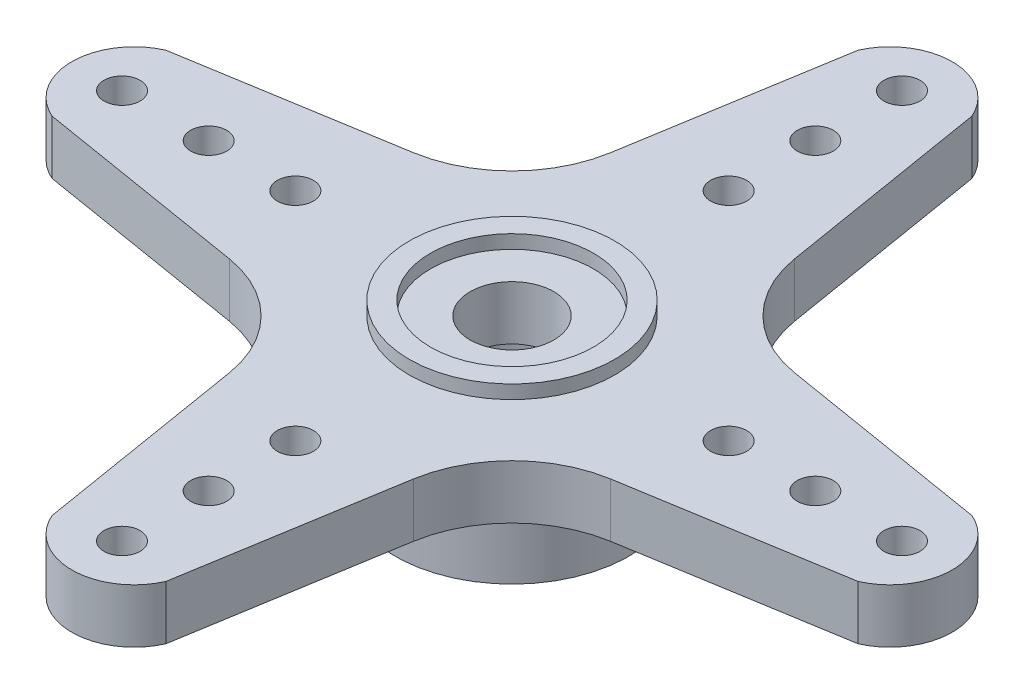
from build123d import *

# Parameters (mm, degrees)
SKETCH1_R           = 4.064
SKETCH1_R_2         = 2.794
BOSS_EXTRUDE1_DEPTH = 3.302
SKETCH2_R           = 0.62500002
SKETCH2_R_2         = 4.064
SKETCH2_R_3         = 2.794
BOSS_EXTRUDE2_DEPTH = 1.87000007
SKETCH6_R           = 1.449999894
CUT_EXTRUDE6_DEPTH  = 23.164493782
SKETCH7_R           = 3.555000002
SKETCH7_R_2         = 2.819999948
BOSS_EXTRUDE3_DEPTH = 0.470000076


with BuildPart() as part:
    # Sketch1 → Boss-Extrude1 (new body)
    with BuildSketch(Plane(origin=(0, 0, 0), x_dir=(1, 0, 0), z_dir=(0, 1, 0))):
        with Locations(Location((0, 0, 0), (0, 0, 90))):
            Circle(SKETCH1_R)
        with Locations(Location((0, 0, 0), (0, 0, 90))):
            Circle(SKETCH1_R_2, mode=Mode.SUBTRACT)
    extrude(amount=BOSS_EXTRUDE1_DEPTH)

    # Sketch2 → Boss-Extrude2 (add)
    # profile 1 of 3: a face of its own
    with BuildSketch(Plane(origin=(0, 3.302, 0), x_dir=(1, 0, 0), z_dir=(0, 1, 0))):
        with BuildLine():
            ThreePointArc((-6.598095019, 3.184398134), (-4.342465091, 4.342465091), (-3.184398134, 6.598095019))
            Line((-3.184398134, 6.598095019), (-1.973411671, 13.950499547))
            ThreePointArc((-1.973411671, 13.950499547), (-1e-09, 15.239999998), (1.973411671, 13.950499548))
            Line((1.973411671, 13.950499548), (3.184398134, 6.598095019))
            ThreePointArc((3.184398134, 6.598095019), (4.342465091, 4.342465091), (6.598095019, 3.184398134))
            Line((6.598095019, 3.184398134), (13.950499547, 1.973411671))
            ThreePointArc((13.950499547, 1.973411671), (15.239999998, 1e-09), (13.950499548, -1.973411671))
            Line((13.950499548, -1.973411671), (6.598095019, -3.184398134))
            ThreePointArc((6.598095019, -3.184398134), (4.342465091, -4.342465091), (3.184398134, -6.598095019))
            Line((3.184398134, -6.598095019), (1.973411671, -13.950499547))
            ThreePointArc((1.973411671, -13.950499547), (1e-09, -15.239999998), (-1.973411671, -13.950499548))
            Line((-1.973411671, -13.950499548), (-3.184398134, -6.598095019))
            ThreePointArc((-3.184398134, -6.598095019), (-4.342465091, -4.342465091), (-6.598095019, -3.184398134))
            Line((-6.598095019, -3.184398134), (-13.950499547, -1.973411671))
            ThreePointArc((-13.950499547, -1.973411671), (-15.239999998, -1e-09), (-13.950499548, 1.973411671))
            Line((-13.950499548, 1.973411671), (-6.598095019, 3.184398134))
        make_face()
        with Locations(Location((-13.500466522, 0, 0), (0, 0, 270))):
            Circle(SKETCH2_R, mode=Mode.SUBTRACT)
        with Locations(Location((-10.500466426, 0, 0), (0, 0, 270))):
            Circle(SKETCH2_R, mode=Mode.SUBTRACT)
        with Locations(Location((-7.50046633, 0, 0), (0, 0, 270))):
            Circle(SKETCH2_R, mode=Mode.SUBTRACT)
        with Locations(Location((13.500466522, 0, 0), (0, 0, 270))):
            Circle(SKETCH2_R, mode=Mode.SUBTRACT)
        with Locations(Location((10.500466426, 0, 0), (0, 0, 270))):
            Circle(SKETCH2_R, mode=Mode.SUBTRACT)
        with Locations(Location((7.50046633, 0, 0), (0, 0, 270))):
            Circle(SKETCH2_R, mode=Mode.SUBTRACT)
        with Locations(Location((0, 7.50046633, 0), (0, 0, 270))):
            Circle(SKETCH2_R, mode=Mode.SUBTRACT)
        with Locations(Location((0, 10.500466426, 0), (0, 0, 270))):
            Circle(SKETCH2_R, mode=Mode.SUBTRACT)
        with Locations(Location((0, 13.500466522, 0), (0, 0, 270))):
            Circle(SKETCH2_R, mode=Mode.SUBTRACT)
        with Locations(Location((0, -13.500466522, 0), (0, 0, 270))):
            Circle(SKETCH2_R, mode=Mode.SUBTRACT)
        with Locations(Location((0, -10.500466426, 0), (0, 0, 270))):
            Circle(SKETCH2_R, mode=Mode.SUBTRACT)
        with Locations(Location((0, -7.50046633, 0), (0, 0, 270))):
            Circle(SKETCH2_R, mode=Mode.SUBTRACT)
        with Locations(Location((0, 0, 0), (0, 0, 90))):
            Circle(SKETCH2_R_2, mode=Mode.SUBTRACT)
    # profile 2 of 3: a face of its own
    with BuildSketch(Plane(origin=(0, 3.302, 0), x_dir=(1, 0, 0), z_dir=(0, 1, 0))):
        with Locations(Location((0, 0, 0), (0, 0, 90))):
            Circle(SKETCH2_R_2)
        with Locations(Location((0, 0, 0), (0, 0, 90))):
            Circle(SKETCH2_R_3, mode=Mode.SUBTRACT)
    # profile 3 of 3: a face of its own
    with BuildSketch(Plane(origin=(0, 3.302, 0), x_dir=(1, 0, 0), z_dir=(0, 1, 0))):
        with Locations(Location((0, 0, 0), (0, 0, 90))):
            Circle(SKETCH2_R_3)
    extrude(amount=BOSS_EXTRUDE2_DEPTH)

    # Sketch6 → Cut-Extrude6 (cut, through all)
    with BuildSketch(Plane(origin=(0, 5.17200007, 0), x_dir=(1, 0, 0), z_dir=(0, 1, 0))):
        with Locations(Location((0, 0, 0), (0, 0, 270))):
            Circle(SKETCH6_R)
    extrude(amount=-CUT_EXTRUDE6_DEPTH, mode=Mode.SUBTRACT)

    # Sketch7 → Boss-Extrude3 (add)
    with BuildSketch(Plane(origin=(0, 5.17200007, 0), x_dir=(1, 0, 0), z_dir=(0, 1, 0))):
        with Locations(Location((0, 0, 0), (0, 0, 270))):
            Circle(SKETCH7_R)
        with Locations(Location((0, 0, 0), (0, 0, 270))):
            Circle(SKETCH7_R_2, mode=Mode.SUBTRACT)
    extrude(amount=BOSS_EXTRUDE3_DEPTH)


solid = part.part
